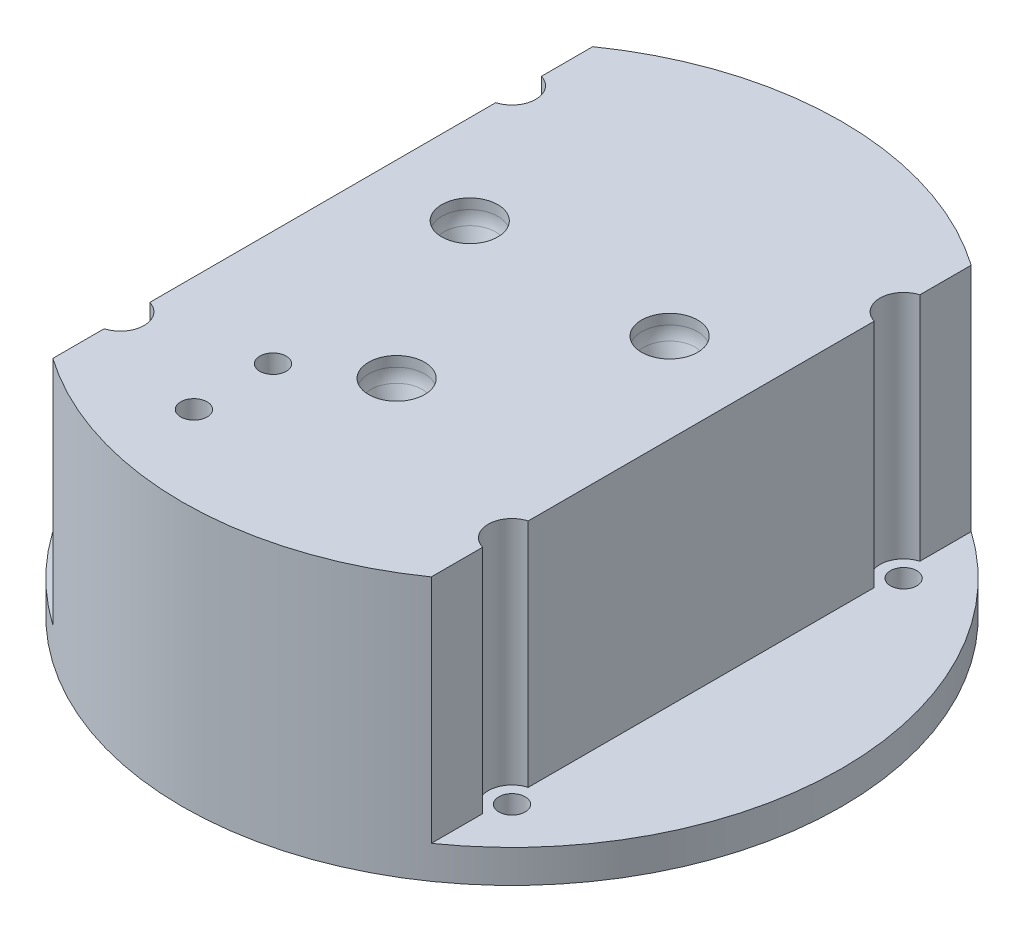
from build123d import *

# Parameters (mm, degrees)
ARA_D_ZLEM_R                    = 50
BASE_DEPTH                      = 5
Y_KSEKLIK_EKSTR_ZYON2_DEPTH     = 40
IZIM2_R                         = 2
BANANA_SLOTLAR_DEPTH            = 82.240384046
IZIM3_R                         = 2
IZIM3_R_2                       = 5.05
KES_EKSTR_ZYON1_DEPTH           = 5
IZIM3_2_R                       = 2
KES_EKSTR_ZYON2_DEPTH           = 82.240384046
IZIM5_R                         = 3.6
KES_EKSTR_ZYON3_DEPTH           = 79.89866919
IZIM6_R                         = 4.25
KES_EKSTR_ZYON4_DEPTH           = 7.5
PAH1_SIZE                       = 5
PAH1_SIZE2                      = 2
RADYUS1_R                       = 5
DAIRESEL_KAPLAMA1_COUNT         = 3
PAH1_OF_DAIRESEL_KAPLAMA1_SIZE2 = 2
PAH1_OF_DAIRESEL_KAPLAMA1_SIZE  = 5
RADYUS1_OF_DAIRESEL_KAPLAMA1_R  = 5


with BuildPart() as part:
    # ara düzlem → base (new body)
    with BuildSketch(Plane(origin=(0, 0, 0), x_dir=(1, 0, 0), z_dir=(0, 1, 0))):
        Circle(ARA_D_ZLEM_R)
    extrude(amount=BASE_DEPTH)

    # Çizim1<3> → Yükseklik-Ekstrüzyon2 (add)
    with BuildSketch(Plane(origin=(0, 0, 0), x_dir=(1, 0, 0), z_dir=(0, 1, 0))):
        with BuildLine():
            ThreePointArc((28.7, 40.942764929), (0, 50), (-28.7, 40.942764929))
            Line((-28.7, 40.942764929), (-28.7, -40.942764929))
            ThreePointArc((-28.7, -40.942764929), (0, -50), (28.7, -40.942764929))
            Line((28.7, -40.942764929), (28.7, 40.942764929))
        make_face()
    extrude(amount=Y_KSEKLIK_EKSTR_ZYON2_DEPTH)

    # Çizim2 → banana slotlar (cut, through all)
    with BuildSketch(Plane(origin=(0, 40, 0), x_dir=(1, 0, 0), z_dir=(0, 1, 0))):
        with Locations((-11.3, -24.942764929)):
            Circle(IZIM2_R)
        with Locations((-11.3, -36.942764929)):
            Circle(IZIM2_R)
    extrude(amount=-BANANA_SLOTLAR_DEPTH, mode=Mode.SUBTRACT)

    # Çizim3 → Kes-Ekstrüzyon1 (cut)
    with BuildSketch(Plane.XZ):
        with Locations((-29.69848481, 29.69848481)):
            Circle(IZIM3_R)
        with Locations((29.69848481, 29.69848481)):
            Circle(IZIM3_R)
        with Locations((29.69848481, -29.69848481)):
            Circle(IZIM3_R)
        with Locations((-29.69848481, -29.69848481)):
            Circle(IZIM3_R)
        Circle(IZIM3_R_2)
    extrude(amount=-KES_EKSTR_ZYON1_DEPTH, mode=Mode.SUBTRACT)

    # Çizim3<2> → Kes-Ekstrüzyon2 (cut, through all)
    with BuildSketch(Plane.XZ):
        with Locations((-29.69848481, 29.69848481)):
            Circle(IZIM3_2_R)
        with Locations((29.69848481, 29.69848481)):
            Circle(IZIM3_2_R)
        with Locations((29.69848481, -29.69848481)):
            Circle(IZIM3_2_R)
        with Locations((-29.69848481, -29.69848481)):
            Circle(IZIM3_2_R)
    extrude(amount=-KES_EKSTR_ZYON2_DEPTH, mode=Mode.SUBTRACT)

    # Çizim5 → Kes-Ekstrüzyon3 (cut, through all)
    with BuildSketch(Plane(origin=(0, 5, 0), x_dir=(1, 0, 0), z_dir=(0, 1, 0))):
        with Locations((29.69848481, -29.69848481)):
            Circle(IZIM5_R)
        with Locations((-29.69848481, -29.69848481)):
            Circle(IZIM5_R)
        with Locations((-29.69848481, 29.69848481)):
            Circle(IZIM5_R)
        with Locations((29.69848481, 29.69848481)):
            Circle(IZIM5_R)
    extrude(amount=KES_EKSTR_ZYON3_DEPTH, mode=Mode.SUBTRACT)

    # Çizim6 → Kes-Ekstrüzyon4 (cut)
    with BuildSketch(Plane(origin=(0, 40, 0), x_dir=(1, 0, 0), z_dir=(0, 1, 0))):
        with Locations((0, -17.5)):
            Circle(IZIM6_R)
    kes_ekstr_zyon4 = extrude(amount=-KES_EKSTR_ZYON4_DEPTH, mode=Mode.SUBTRACT)

    # Pah1
    pah1_edges = [part.edges().sort_by_distance(p)[0] for p in [
        (-4.25, 32.5, 17.5),
    ]]
    pah1_side = [part.faces().sort_by_distance(p)[0] for p in [
        (-4.25, 36.25, 17.5),
    ]]
    chamfer(pah1_edges, length=PAH1_SIZE, length2=PAH1_SIZE2, reference=pah1_side[0])

    # Radyus1
    radyus1_edges = [part.edges().sort_by_distance(p)[0] for p in [
        (-4.25, 37.5, 17.5),
    ]]
    fillet(radyus1_edges, radius=RADYUS1_R)

    # Dairesel Kaplama1: Kes-Ekstrüzyon4 ×3 about axis
    dairesel_kaplama1_axis = Axis((0, 5, 0), (0, -1, 0))
    for i in range(1, DAIRESEL_KAPLAMA1_COUNT):
        add(kes_ekstr_zyon4.rotate(dairesel_kaplama1_axis, i * 360 / DAIRESEL_KAPLAMA1_COUNT), mode=Mode.SUBTRACT)

    # Pah1 of Dairesel Kaplama1
    pah1_of_dairesel_kaplama1_edges = [part.edges().sort_by_distance(p)[0] for p in [
        (-13.030444566, 32.5, -12.430607966),
        (17.280444566, 32.5, -5.069392034),
    ]]
    chamfer(pah1_of_dairesel_kaplama1_edges, length=PAH1_OF_DAIRESEL_KAPLAMA1_SIZE, length2=PAH1_OF_DAIRESEL_KAPLAMA1_SIZE2)

    # Radyus1 of Dairesel Kaplama1
    radyus1_of_dairesel_kaplama1_edges = [part.edges().sort_by_distance(p)[0] for p in [
        (-13.030444566, 37.5, -12.430607966),
        (17.280444566, 37.5, -5.069392034),
    ]]
    fillet(radyus1_of_dairesel_kaplama1_edges, radius=RADYUS1_OF_DAIRESEL_KAPLAMA1_R)


solid = part.part
